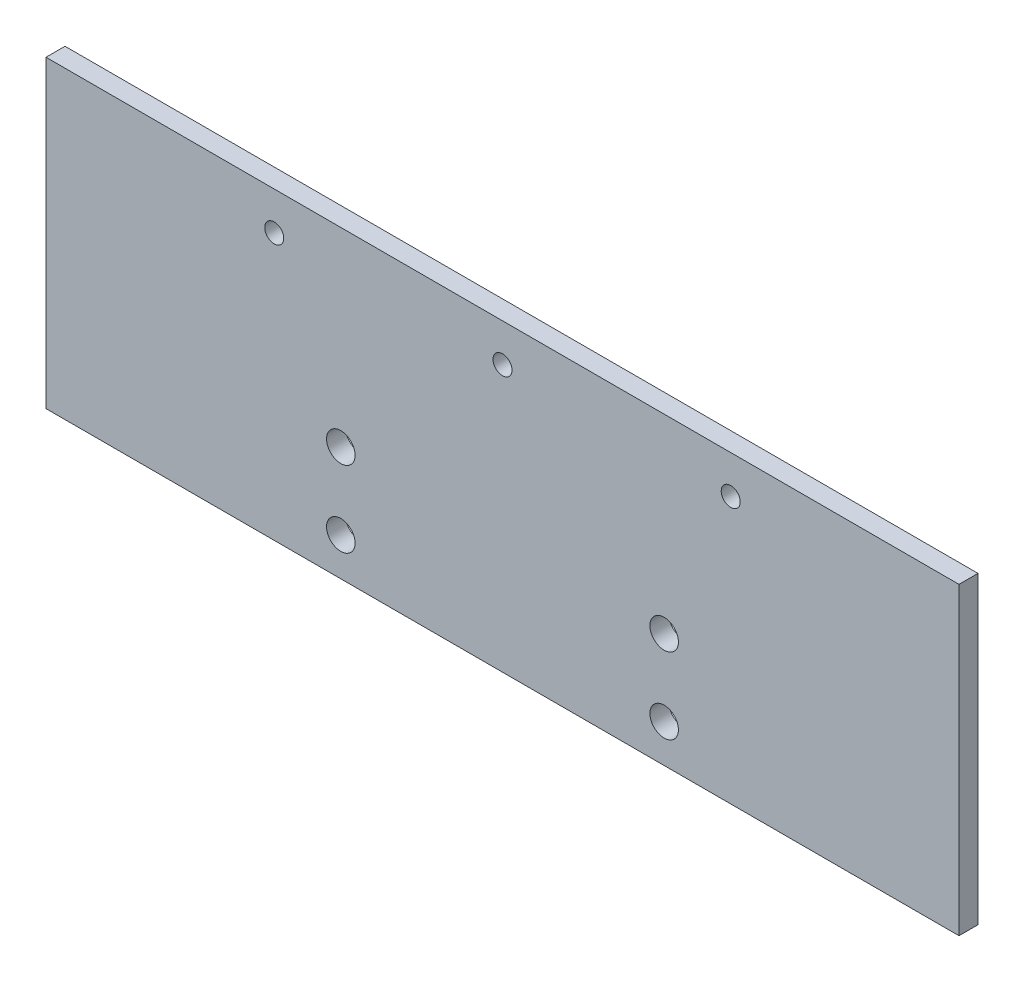
from build123d import *

# Parameters (mm, degrees)
SKETCH1_W           = 304.8
SKETCH1_H           = 101.6
BOSS_EXTRUDE1_DEPTH = 6.35
SKETCH2_R           = 3.175
SKETCH2_R_2         = 4.7625
CUT_EXTRUDE1_DEPTH  = 6.35


with BuildPart() as part:
    # Sketch1 → Boss-Extrude1 (new body)
    with BuildSketch(Plane.XY):
        with Locations((152.4, -50.8)):
            Rectangle(SKETCH1_W, SKETCH1_H)
    extrude(amount=BOSS_EXTRUDE1_DEPTH)

    # Sketch2 → Cut-Extrude1 (cut)
    with BuildSketch(Plane.XY.offset(6.35)):
        with Locations((76.2, -12.7)):
            Circle(SKETCH2_R)
        with Locations((152.4, -12.7)):
            Circle(SKETCH2_R)
        with Locations((228.6, -12.7)):
            Circle(SKETCH2_R)
        with Locations((98.425, -63.5)):
            Circle(SKETCH2_R_2)
        with Locations((206.375, -63.5)):
            Circle(SKETCH2_R_2)
        with Locations((98.425, -88.9)):
            Circle(SKETCH2_R_2)
        with Locations((206.375, -88.9)):
            Circle(SKETCH2_R_2)
    extrude(amount=-CUT_EXTRUDE1_DEPTH, mode=Mode.SUBTRACT)


solid = part.part
